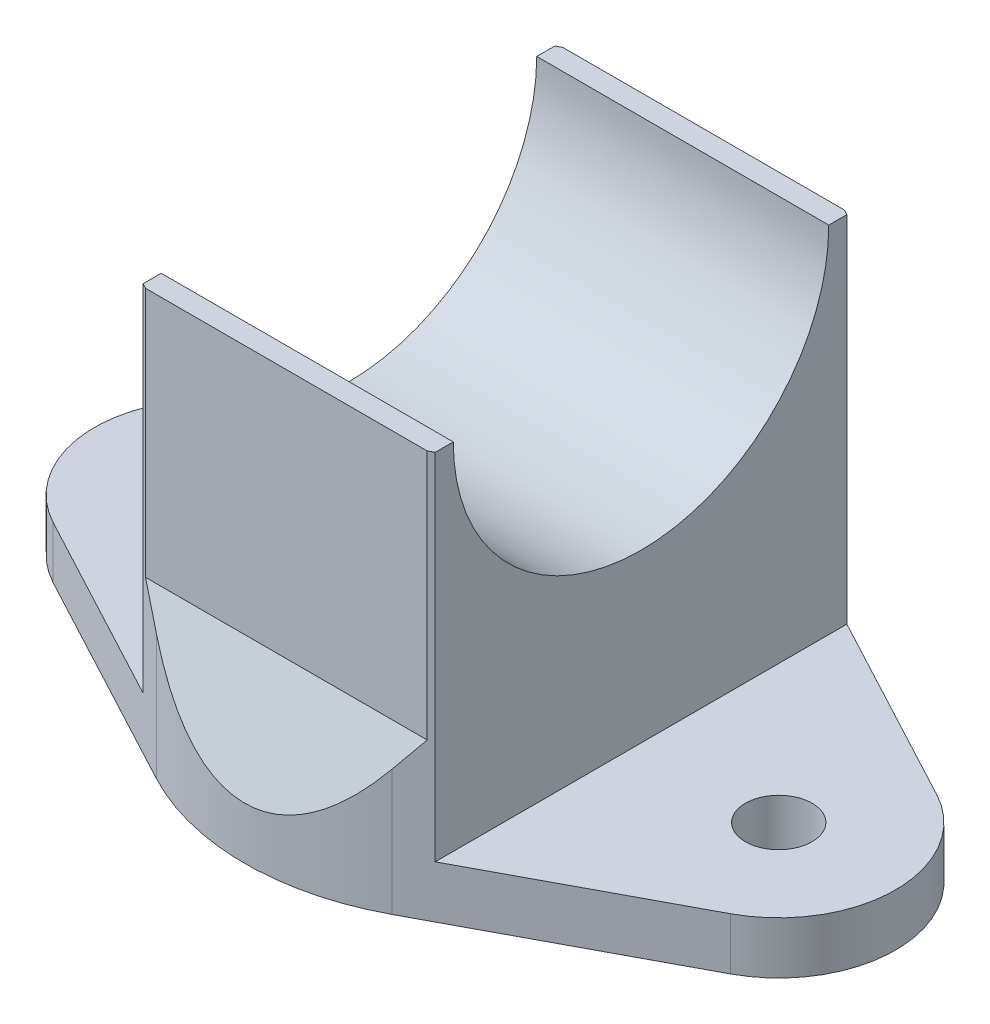
from build123d import *

# Parameters (mm, degrees)
SKETCH_1_R               = 1.6
EXTRUDE_1_DEPTH          = 2.5
EXTRUDE_2_DEPTH          = 7
EXTRUDE_2_DEPTH_BACK     = 7
SKETCH_4_R               = 25
CUT_EXTRUDE_3_DEPTH      = 29.313247783
CUT_EXTRUDE_4_DEPTH      = 10
CUT_EXTRUDE_4_DEPTH_BACK = 10
SKETCH_7_R               = 9


with BuildPart() as part:
    # 草图1 → 凸台-拉伸1 (new body)
    with BuildSketch(Plane(origin=(0, 0, 0), x_dir=(1, 0, 0), z_dir=(0, 1, 0))):
        with BuildLine():
            Line((16.235294118, -4.941176471), (5.647058824, -10.588235294))
            ThreePointArc((5.647058824, -10.588235294), (0, -12), (-5.647058824, -10.588235294))
            Line((-5.647058824, -10.588235294), (-16.235294118, -4.941176471))
            ThreePointArc((-16.235294118, -4.941176471), (-19.2, 0), (-16.235294118, 4.941176471))
            Line((-16.235294118, 4.941176471), (-5.647058824, 10.588235294))
            ThreePointArc((-5.647058824, 10.588235294), (0, 12), (5.647058824, 10.588235294))
            Line((5.647058824, 10.588235294), (16.235294118, 4.941176471))
            ThreePointArc((16.235294118, 4.941176471), (19.2, 0), (16.235294118, -4.941176471))
        make_face()
        with Locations((-13.6, 0)):
            Circle(SKETCH_1_R, mode=Mode.SUBTRACT)
        with Locations((13.6, 0)):
            Circle(SKETCH_1_R, mode=Mode.SUBTRACT)
    extrude(amount=-EXTRUDE_1_DEPTH)

    # 草图2 → 凸台-拉伸2 (add, two sides: drawn at the far end of the back side and taken through both)
    with BuildSketch(Plane(origin=(0, 0, 0), x_dir=(0, 0, -1), z_dir=(1, 0, 0)).offset(-EXTRUDE_2_DEPTH_BACK)):
        Polygon((12, 0), (-12, 0), (-10, 5), (-10, 17), (10, 17), (10, 5), align=None)
    extrude(amount=EXTRUDE_2_DEPTH + EXTRUDE_2_DEPTH_BACK)

    # 草图4 → 切除-拉伸3 (cut, through all)
    with BuildSketch(Plane(origin=(0, 0, 0), x_dir=(1, 0, 0), z_dir=(0, 1, 0))):
        Circle(SKETCH_4_R)
        with BuildLine():
            Line((5.647058824, -10.588235294), (7, -9.866666667))
            Line((7, -9.866666667), (16.235294118, -4.941176471))
            ThreePointArc((16.235294118, -4.941176471), (19.2, 0), (16.235294118, 4.941176471))
            Line((16.235294118, 4.941176471), (7, 9.866666667))
            Line((7, 9.866666667), (5.647058824, 10.588235294))
            ThreePointArc((5.647058824, 10.588235294), (2.9104275, 11.641710002), (0, 12))
            ThreePointArc((0, 12), (-2.9104275, 11.641710002), (-5.647058824, 10.588235294))
            Line((-5.647058824, 10.588235294), (-7, 9.866666667))
            Line((-7, 9.866666667), (-16.235294118, 4.941176471))
            ThreePointArc((-16.235294118, 4.941176471), (-19.2, 0), (-16.235294118, -4.941176471))
            Line((-16.235294118, -4.941176471), (-7, -9.866666667))
            Line((-7, -9.866666667), (-5.647058824, -10.588235294))
            ThreePointArc((-5.647058824, -10.588235294), (-2.9104275, -11.641710002), (0, -12))
            ThreePointArc((0, -12), (2.9104275, -11.641710002), (5.647058824, -10.588235294))
        make_face(mode=Mode.SUBTRACT)
    extrude(amount=CUT_EXTRUDE_3_DEPTH, mode=Mode.SUBTRACT)

    # 草图7 → 切除-拉伸4 (cut, two sides: drawn at the far end of the back side and taken through both)
    with BuildSketch(Plane(origin=(0, 0, 0), x_dir=(0, 0, -1), z_dir=(1, 0, 0)).offset(-CUT_EXTRUDE_4_DEPTH_BACK)):
        with Locations((0, 17)):
            Circle(SKETCH_7_R)
    extrude(amount=CUT_EXTRUDE_4_DEPTH + CUT_EXTRUDE_4_DEPTH_BACK, mode=Mode.SUBTRACT)


solid = part.part
